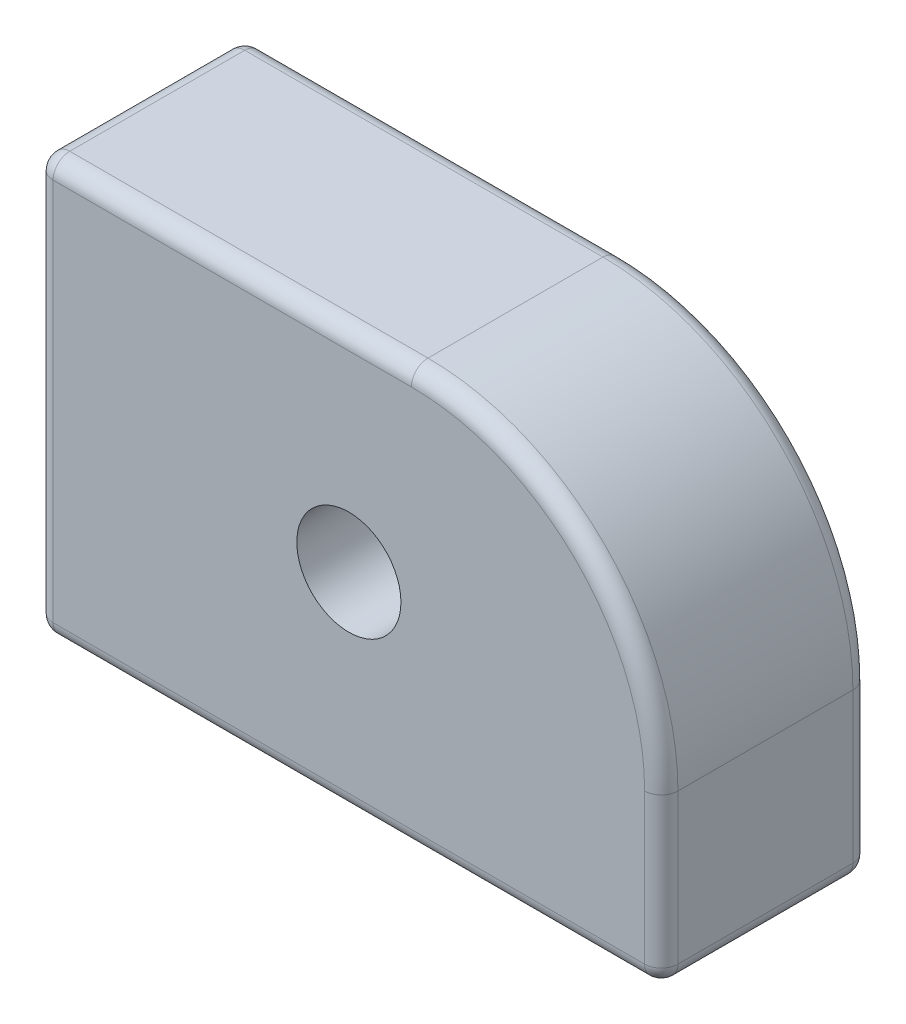
from build123d import *

# Parameters (mm, degrees)
SKETCH1_R           = 12.5
BOSS_EXTRUDE1_DEPTH = 25
SKETCH2_R           = 15
CUT_EXTRUDE1_DEPTH  = 60
FILLET1_R           = 4


with BuildPart() as part:
    # Sketch1 → Boss-Extrude1 (new, symmetric)
    with BuildSketch(Plane.XY):
        with BuildLine():
            Line((-75, -50), (75, -50))
            Line((75, -50), (75, -10))
            ThreePointArc((75, -10), (57.426406871, 32.426406871), (15, 50))
            Line((15, 50), (-75, 50))
            Line((-75, 50), (-75, -50))
        make_face()
        Circle(SKETCH1_R, mode=Mode.SUBTRACT)
    extrude(amount=BOSS_EXTRUDE1_DEPTH, both=True)

    # Sketch2 → Cut-Extrude1 (cut)
    with BuildSketch(Plane.ZY.offset(75)):
        Circle(SKETCH2_R)
    extrude(amount=-CUT_EXTRUDE1_DEPTH, mode=Mode.SUBTRACT)

    # Fillet1
    fillet1_edges = [part.edges().sort_by_distance(p)[0] for p in [
        (0, -50, -25),
        (75, -30, -25),
        (57.426406871, 32.426406871, -25),
        (-30, 50, -25),
        (57.426406871, 32.426406871, 25),
        (75, -30, 25),
        (0, -50, 25),
        (-75, 0, 25),
        (-30, 50, 25),
        (-75, 0, -25),
        (75, -50, 0),
        (-75, -50, 0),
        (-75, 50, 0),
    ]]
    fillet(fillet1_edges, radius=FILLET1_R)


solid = part.part
